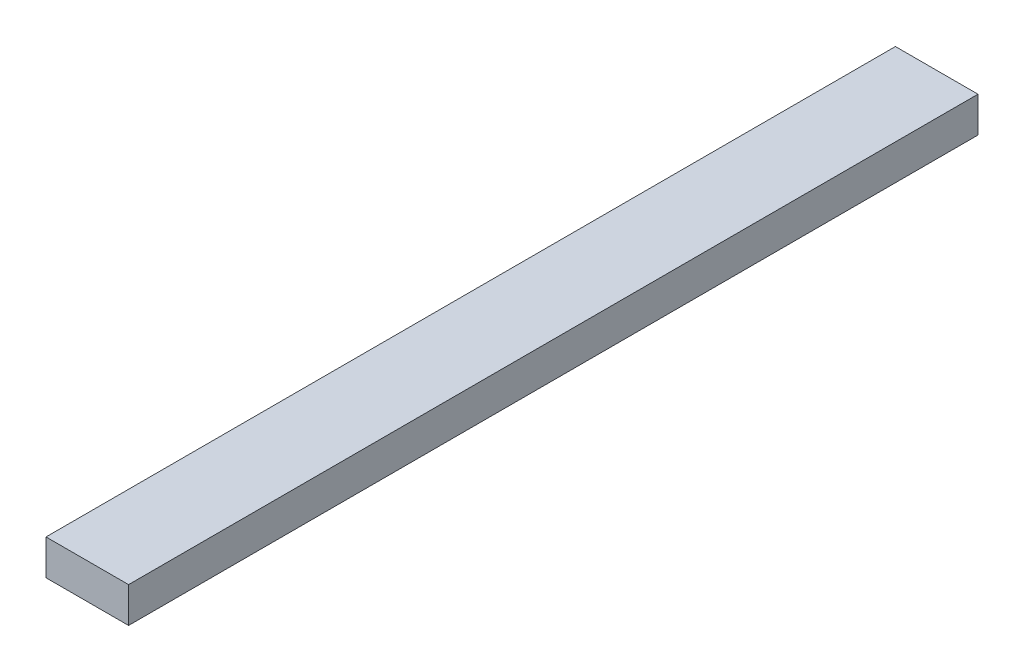
from build123d import *

# Parameters (mm, degrees)
SKETCH1_W           = 88.9
SKETCH1_H           = 38.1
BOSS_EXTRUDE1_DEPTH = 914.4


with BuildPart() as part:
    # Sketch1 → Boss-Extrude1 (new body)
    with BuildSketch(Plane.XY):
        with Locations((-869.95, -19.05)):
            Rectangle(SKETCH1_W, SKETCH1_H)
    extrude(amount=-BOSS_EXTRUDE1_DEPTH)


solid = part.part
